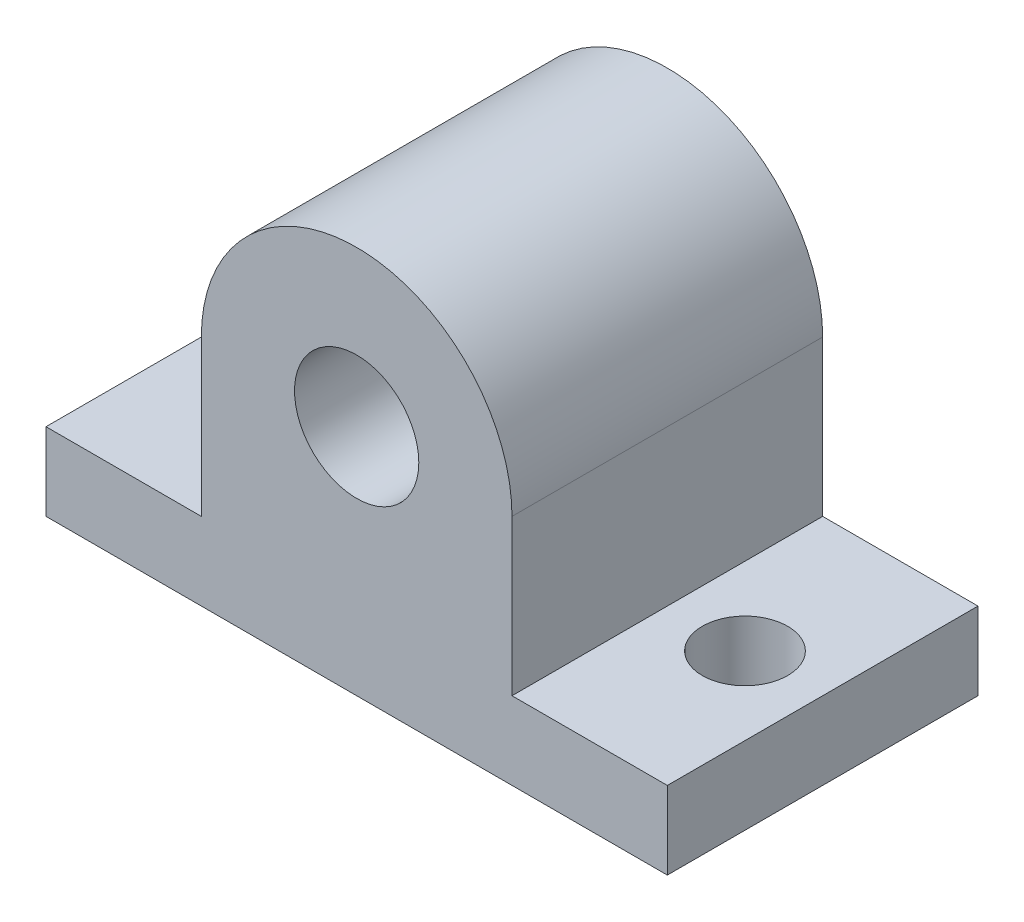
from build123d import *

# Parameters (mm, degrees)
SKETCH_1_W          = 40
SKETCH_1_H          = 20
EXTRUDE_1_DEPTH     = 5
SKETCH_2_R          = 4
EXTRUDE_2_DEPTH     = 20
SKETCH_3_R          = 2.75
CUT_EXTRUDE_1_DEPTH = 35.395156331


with BuildPart() as part:
    # 草图1 → 凸台-拉伸1 (new body)
    with BuildSketch(Plane(origin=(0, 0, 0), x_dir=(1, 0, 0), z_dir=(0, 1, 0))):
        with Locations((3.522012579, -5.157232704)):
            Rectangle(SKETCH_1_W, SKETCH_1_H)
    extrude(amount=EXTRUDE_1_DEPTH)

    # 草图2 → 凸台-拉伸2 (add)
    with BuildSketch(Plane.XY.offset(15.157232704)):
        with BuildLine():
            Line((-6.477987421, 15), (-6.477987421, 5))
            Line((-6.477987421, 5), (13.522012579, 5))
            Line((13.522012579, 5), (13.522012579, 15))
            ThreePointArc((13.522012579, 15), (3.522012579, 25), (-6.477987421, 15))
        make_face()
        with Locations((3.522012579, 15)):
            Circle(SKETCH_2_R, mode=Mode.SUBTRACT)
    extrude(amount=-EXTRUDE_2_DEPTH)

    # 草图3 → 切除-拉伸1 (cut, through all)
    with BuildSketch(Plane(origin=(0, 5, 0), x_dir=(1, 0, 0), z_dir=(0, 1, 0))):
        with Locations(Location((-11.477987421, -5.157232704, 0), (0, 0, 270))):
            Circle(SKETCH_3_R)
        with Locations(Location((18.522012579, -5.157232704, 0), (0, 0, 270))):
            Circle(SKETCH_3_R)
    extrude(amount=-CUT_EXTRUDE_1_DEPTH, mode=Mode.SUBTRACT)


solid = part.part
